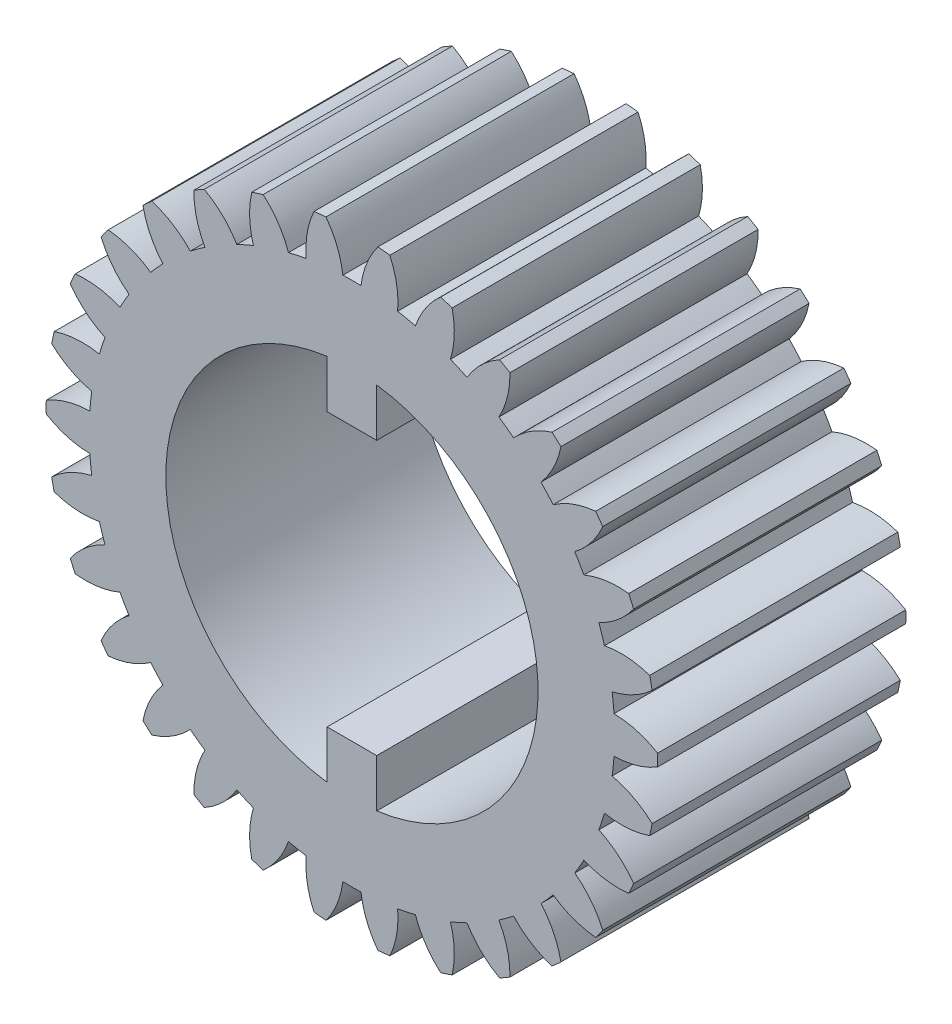
from build123d import *

# Parameters (mm, degrees)
SKETCH_1_R               = 12.32
EXTRUDE_1_DEPTH          = 5
PATTERN_CIRCULAR_1_COUNT = 30
CUT_EXTRUDE_1_DEPTH      = 10


with BuildPart() as part:
    # Эскиз1 → Бобышка-Вытянуть1 (new, symmetric)
    with BuildSketch(Plane.XY):
        Circle(SKETCH_1_R)
    extrude(amount=EXTRUDE_1_DEPTH, both=True)

    # Эскиз5 for Вырез-По сечениям1 → Вырез-По сечениям1 section 0
    with BuildSketch(Plane.XY.offset(-5)):
        with BuildLine():
            # circular arc as an exact rational Bezier (weights 1, cos(half-angle), 1)
            Bezier((-1.458691761, 12.736742847), (-0.522105639, 11.856767026), (-0.365824723, 10.581178031), weights=[1, 0.940287899, 1])
            Bezier((-0.365824723, 10.581178031), (0, 10.593825746), (0.365824723, 10.581178031), weights=[1, 0.999402884, 1])
            Bezier((0.365824723, 10.581178031), (0.522105639, 11.856767026), (1.458691761, 12.736742847), weights=[1, 0.940287899, 1])
            Bezier((1.458691761, 12.736742847), (0, 12.903801386), (-1.458691761, 12.736742847), weights=[1, 0.993505682, 1])
        make_face()
    # Эскиз2 for Вырез-По сечениям1 → Вырез-По сечениям1 section 1
    with BuildSketch(Plane.XY.offset(5)):
        with BuildLine():
            Bezier((-1.458691761, 12.736742847), (-0.522105639, 11.856767026), (-0.365824723, 10.581178031), weights=[1, 0.940287899, 1])
            Bezier((-0.365824723, 10.581178031), (0, 10.593825746), (0.365824723, 10.581178031), weights=[1, 0.999402884, 1])
            Bezier((0.365824723, 10.581178031), (0.522105639, 11.856767026), (1.458691761, 12.736742847), weights=[1, 0.940287899, 1])
            Bezier((1.458691761, 12.736742847), (0, 12.903801386), (-1.458691761, 12.736742847), weights=[1, 0.993505682, 1])
        make_face()
    loft_1 = loft(mode=Mode.SUBTRACT)

    # Круговой массив1: Вырез-По сечениям1 ×30 about axis
    pattern_circular_1_axis = Axis((0, 0, 0), (0, 0, 1))
    for i in range(1, PATTERN_CIRCULAR_1_COUNT):
        add(loft_1.rotate(pattern_circular_1_axis, i * 360 / PATTERN_CIRCULAR_1_COUNT), mode=Mode.SUBTRACT)

    # Эскиз6 → Вырез-Вытянуть1 (cut)
    with BuildSketch(Plane.XY.offset(5)):
        with BuildLine():
            Line((-1, 5.5), (-1, 7.433034374))
            ThreePointArc((-1, 7.433034374), (-7.5, 0), (-1, -7.433034374))
            Line((-1, -7.433034374), (-1, -5.5))
            Line((-1, -5.5), (1, -5.5))
            Line((1, -5.5), (1, -7.433034374))
            ThreePointArc((1, -7.433034374), (5.645794895, -4.937104415), (7.5, 0))
            ThreePointArc((7.5, 0), (5.645794895, 4.937104415), (1, 7.433034374))
            Line((1, 7.433034374), (1, 5.5))
            Line((1, 5.5), (-1, 5.5))
        make_face()
    extrude(amount=-CUT_EXTRUDE_1_DEPTH, mode=Mode.SUBTRACT)


solid = part.part
